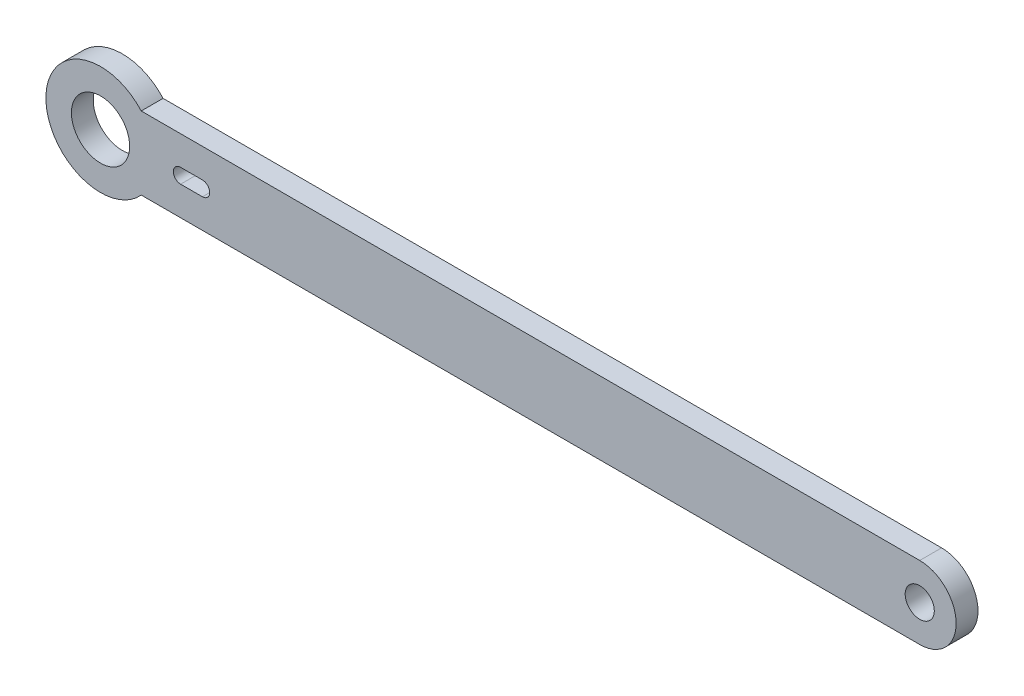
from build123d import *

# Parameters (mm, degrees)
SKETCH_1_R      = 2
SKETCH_1_R_2    = 4
EXTRUDE_1_DEPTH = 1.5


with BuildPart() as part:
    # 草图1 → 凸台-拉伸1 (new, symmetric)
    with BuildSketch(Plane.XY):
        with BuildLine():
            Line((5.590169944, 5), (112.5, 5))
            ThreePointArc((112.5, 5), (117.5, 0), (112.5, -5))
            Line((112.5, -5), (5.590169944, -5))
            ThreePointArc((5.590169944, -5), (-7.5, 0), (5.590169944, 5))
        make_face()
        with Locations((112.5, 0)):
            Circle(SKETCH_1_R, mode=Mode.SUBTRACT)
        Circle(SKETCH_1_R_2, mode=Mode.SUBTRACT)
        with BuildLine():
            Line((11, 1), (14, 1))
            ThreePointArc((14, 1), (15, 0), (14, -1))
            Line((14, -1), (11, -1))
            ThreePointArc((11, -1), (10, 0), (11, 1))
        make_face(mode=Mode.SUBTRACT)
    extrude(amount=EXTRUDE_1_DEPTH, both=True)


solid = part.part
